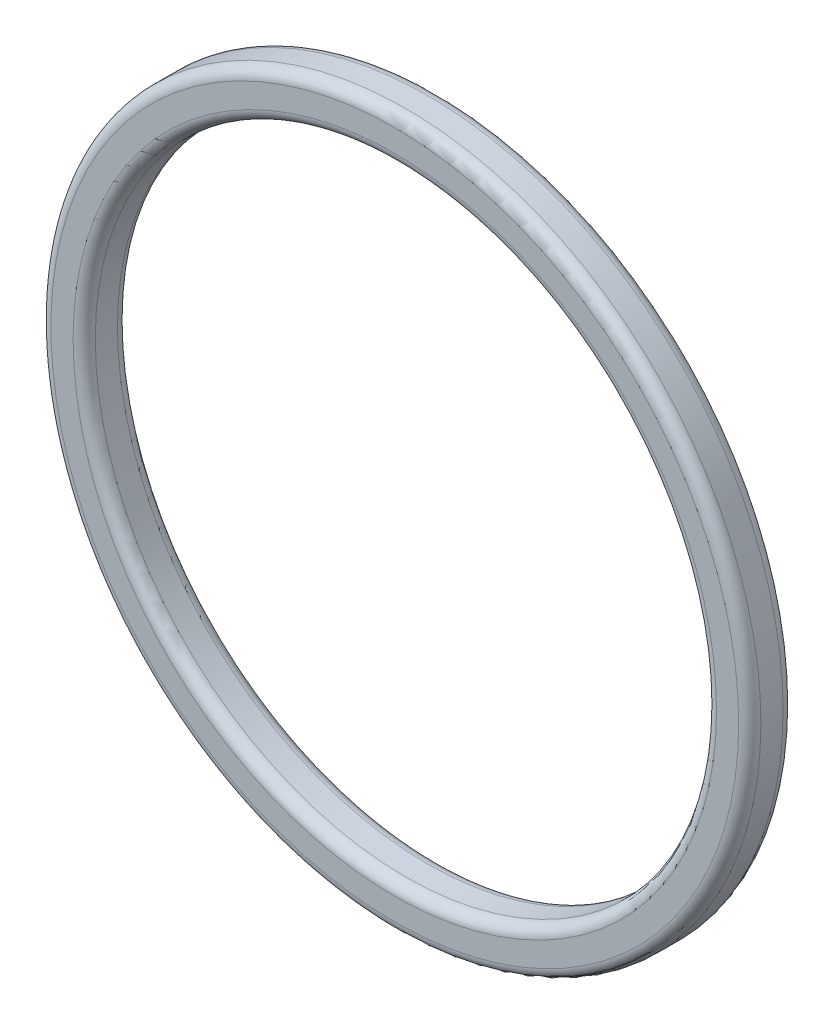
from build123d import *

# Parameters (mm, degrees)
SKETCH1_R           = 8
SKETCH1_R_2         = 7
BOSS_EXTRUDE1_DEPTH = 1
FILLET1_R           = 0.25
FILLET2_R           = 0.25
FILLET3_R           = 0.25
FILLET4_R           = 0.25


with BuildPart() as part:
    # Sketch1 → Boss-Extrude1 (new body)
    with BuildSketch(Plane.XY):
        Circle(SKETCH1_R)
        Circle(SKETCH1_R_2, mode=Mode.SUBTRACT)
    extrude(amount=BOSS_EXTRUDE1_DEPTH)

    # Fillet1
    fillet1_edges = [part.edges().sort_by_distance(p)[0] for p in [
        (-8, 0, 1),
    ]]
    fillet(fillet1_edges, radius=FILLET1_R)

    # Fillet2
    fillet2_edges = [part.edges().sort_by_distance(p)[0] for p in [
        (-7, 0, 1),
    ]]
    fillet(fillet2_edges, radius=FILLET2_R)

    # Fillet3
    fillet3_edges = [part.edges().sort_by_distance(p)[0] for p in [
        (-8, 0, 0),
    ]]
    fillet(fillet3_edges, radius=FILLET3_R)

    # Fillet4
    fillet4_edges = [part.edges().sort_by_distance(p)[0] for p in [
        (-7, 0, 0),
    ]]
    fillet(fillet4_edges, radius=FILLET4_R)


solid = part.part
